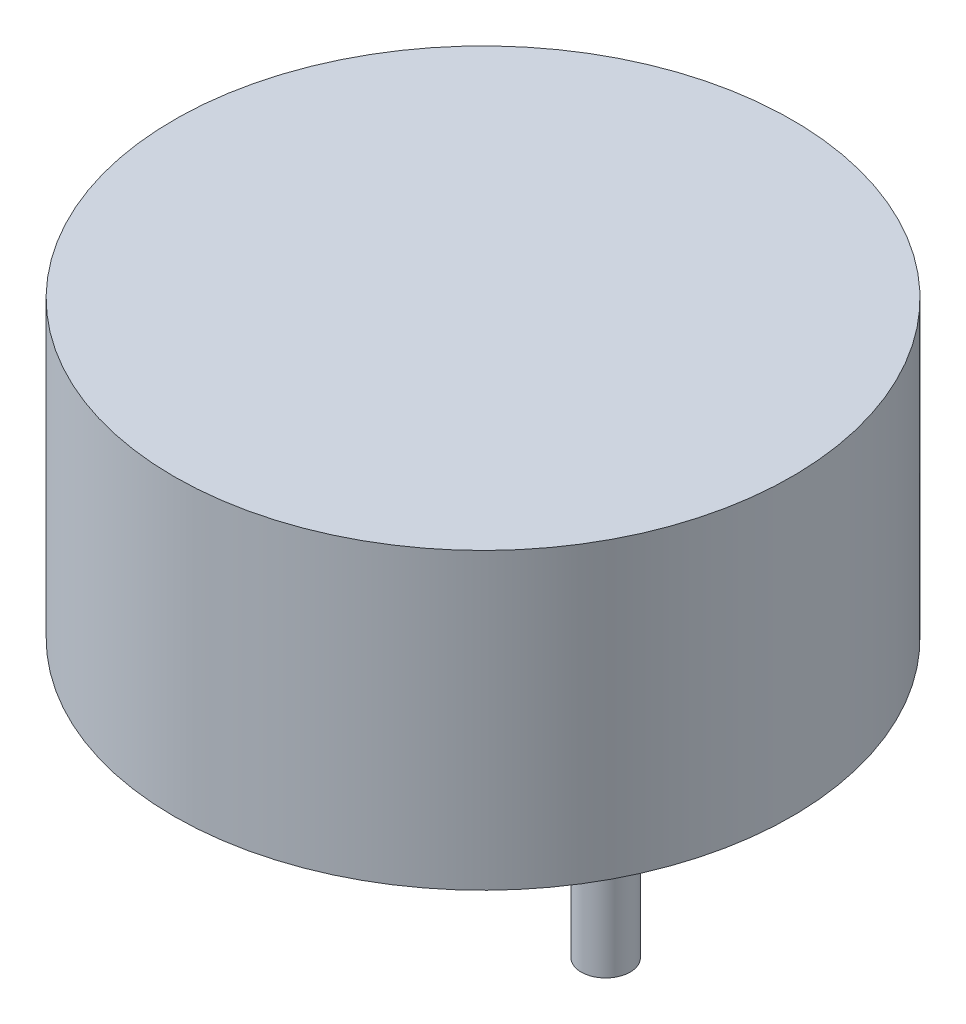
from build123d import *

# Parameters (mm, degrees)
SKETCH1_R           = 6.3
BOSS_EXTRUDE1_DEPTH = 6
SKETCH2_R           = 1.25
BOSS_EXTRUDE2_DEPTH = 0.9
SKETCH3_R           = 0.5
BOSS_EXTRUDE3_DEPTH = 3.5


with BuildPart() as part:
    # Sketch1 → Boss-Extrude1 (new body)
    with BuildSketch(Plane(origin=(0, 0, 0), x_dir=(1, 0, 0), z_dir=(0, 1, 0))):
        with Locations(Location((0, 0, 0), (0, 0, 270))):
            Circle(SKETCH1_R)
    extrude(amount=BOSS_EXTRUDE1_DEPTH)

    # Sketch2 → Boss-Extrude2 (add)
    with BuildSketch(Plane.XZ):
        with Locations(Location((2.5, 0, 0), (0, 0, 90))):
            Circle(SKETCH2_R)
    boss_extrude2 = extrude(amount=BOSS_EXTRUDE2_DEPTH)

    # Sketch3 → Boss-Extrude3 (add)
    with BuildSketch(Plane.XZ.offset(0.9)):
        with Locations(Location((2.5, 0, 0), (0, 0, 270))):
            Circle(SKETCH3_R)
    boss_extrude3 = extrude(amount=BOSS_EXTRUDE3_DEPTH)

    # Mirror1: Boss-Extrude2, Boss-Extrude3 across plane
    add(boss_extrude2.mirror(Plane(origin=(0, 0, 0), x_dir=(0, 0, 1), z_dir=(1, 0, 0))))
    add(boss_extrude3.mirror(Plane(origin=(0, 0, 0), x_dir=(0, 0, 1), z_dir=(1, 0, 0))))


solid = part.part
